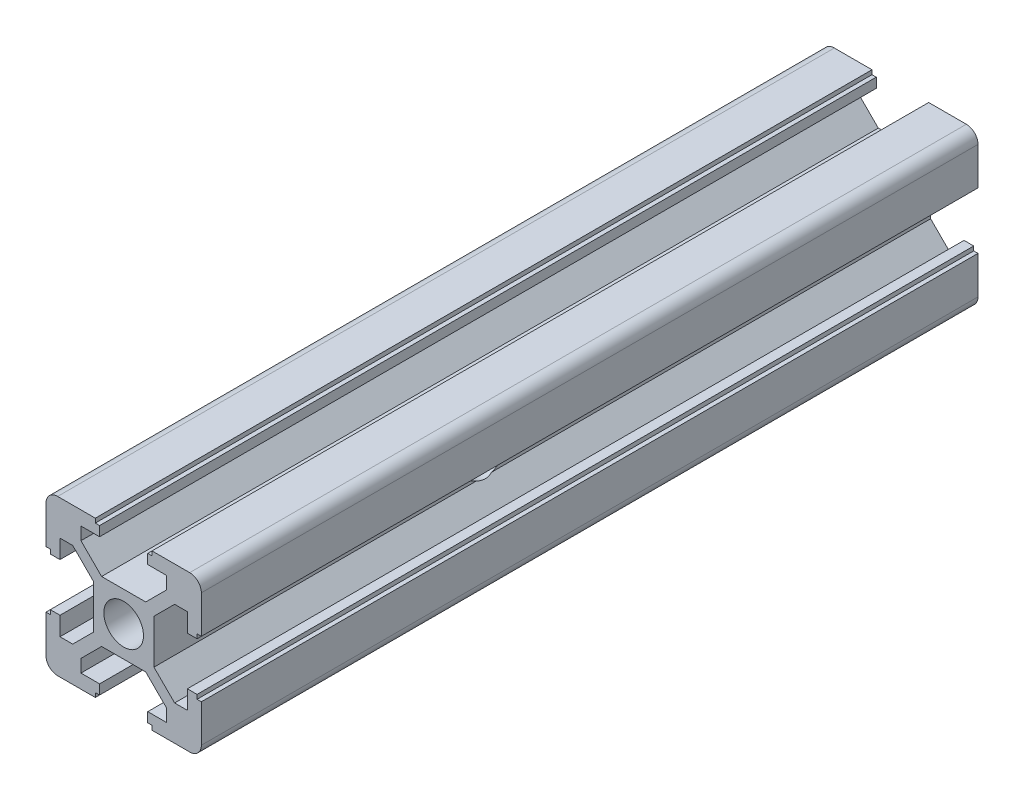
from build123d import *

# Parameters (mm, degrees)
SKETCH_2_R          = 2.55
EXTRUDE_1_DEPTH     = 100
SKETCH_3_R          = 3
CUT_EXTRUDE_1_DEPTH = 103.46950766


with BuildPart() as part:
    # 草图2 → 凸台-拉伸1 (new body)
    with BuildSketch(Plane.XY):
        with BuildLine():
            Line((-3.9, 2.839339828), (-6.560660172, 5.5))
            Line((-6.560660172, 5.5), (-8.2, 5.5))
            Line((-8.2, 5.5), (-8.2, 3.1))
            Line((-8.2, 3.1), (-9.45, 3.1))
            Line((-9.45, 3.1), (-9.45, 3.65))
            Line((-9.45, 3.65), (-10, 3.65))
            Line((-10, 3.65), (-10, 8.5))
            ThreePointArc((-10, 8.5), (-9.560660172, 9.560660172), (-8.5, 10))
            Line((-8.5, 10), (-3.65, 10))
            Line((-3.65, 10), (-3.65, 9.45))
            Line((-3.65, 9.45), (-3.1, 9.45))
            Line((-3.1, 9.45), (-3.1, 8.2))
            Line((-3.1, 8.2), (-5.5, 8.2))
            Line((-5.5, 8.2), (-5.5, 6.560660172))
            Line((-5.5, 6.560660172), (-2.839339828, 3.9))
            Line((-2.839339828, 3.9), (2.839339828, 3.9))
            Line((2.839339828, 3.9), (5.5, 6.560660172))
            Line((5.5, 6.560660172), (5.5, 8.2))
            Line((5.5, 8.2), (3.1, 8.2))
            Line((3.1, 8.2), (3.1, 9.45))
            Line((3.1, 9.45), (3.65, 9.45))
            Line((3.65, 9.45), (3.65, 10))
            Line((3.65, 10), (8.5, 10))
            ThreePointArc((8.5, 10), (9.560660172, 9.560660172), (10, 8.5))
            Line((10, 8.5), (10, 3.65))
            Line((10, 3.65), (9.45, 3.65))
            Line((9.45, 3.65), (9.45, 3.1))
            Line((9.45, 3.1), (8.2, 3.1))
            Line((8.2, 3.1), (8.2, 5.5))
            Line((8.2, 5.5), (6.560660172, 5.5))
            Line((6.560660172, 5.5), (3.9, 2.839339828))
            Line((3.9, 2.839339828), (3.9, -2.839339828))
            Line((3.9, -2.839339828), (6.560660172, -5.5))
            Line((6.560660172, -5.5), (8.2, -5.5))
            Line((8.2, -5.5), (8.2, -3.1))
            Line((8.2, -3.1), (9.45, -3.1))
            Line((9.45, -3.1), (9.45, -3.65))
            Line((9.45, -3.65), (10, -3.65))
            Line((10, -3.65), (10, -8.5))
            ThreePointArc((10, -8.5), (9.560660172, -9.560660172), (8.5, -10))
            Line((8.5, -10), (3.65, -10))
            Line((3.65, -10), (3.65, -9.45))
            Line((3.65, -9.45), (3.1, -9.45))
            Line((3.1, -9.45), (3.1, -8.2))
            Line((3.1, -8.2), (5.5, -8.2))
            Line((5.5, -8.2), (5.5, -6.560660172))
            Line((5.5, -6.560660172), (2.839339828, -3.9))
            Line((2.839339828, -3.9), (-2.839339828, -3.9))
            Line((-2.839339828, -3.9), (-5.5, -6.560660172))
            Line((-5.5, -6.560660172), (-5.5, -8.2))
            Line((-5.5, -8.2), (-3.1, -8.2))
            Line((-3.1, -8.2), (-3.1, -9.45))
            Line((-3.1, -9.45), (-3.65, -9.45))
            Line((-3.65, -9.45), (-3.65, -10))
            Line((-3.65, -10), (-8.5, -10))
            ThreePointArc((-8.5, -10), (-9.560660172, -9.560660172), (-10, -8.5))
            Line((-10, -8.5), (-10, -3.65))
            Line((-10, -3.65), (-9.45, -3.65))
            Line((-9.45, -3.65), (-9.45, -3.1))
            Line((-9.45, -3.1), (-8.2, -3.1))
            Line((-8.2, -3.1), (-8.2, -5.5))
            Line((-8.2, -5.5), (-6.560660172, -5.5))
            Line((-6.560660172, -5.5), (-3.9, -2.839339828))
            Line((-3.9, -2.839339828), (-3.9, 2.839339828))
        make_face()
        Circle(SKETCH_2_R, mode=Mode.SUBTRACT)
    extrude(amount=EXTRUDE_1_DEPTH)

    # 草图3 → 切除-拉伸1 (cut, through all)
    with BuildSketch(Plane(origin=(10, 0, 0), x_dir=(0, 0, -1), z_dir=(1, 0, 0))):
        with Locations(Location((-57.5, 0, 0), (0, 0, 71.16400384))):
            Circle(SKETCH_3_R)
        with Locations((-302.5, 0)):
            Circle(SKETCH_3_R)
    extrude(amount=-CUT_EXTRUDE_1_DEPTH, mode=Mode.SUBTRACT)


solid = part.part
